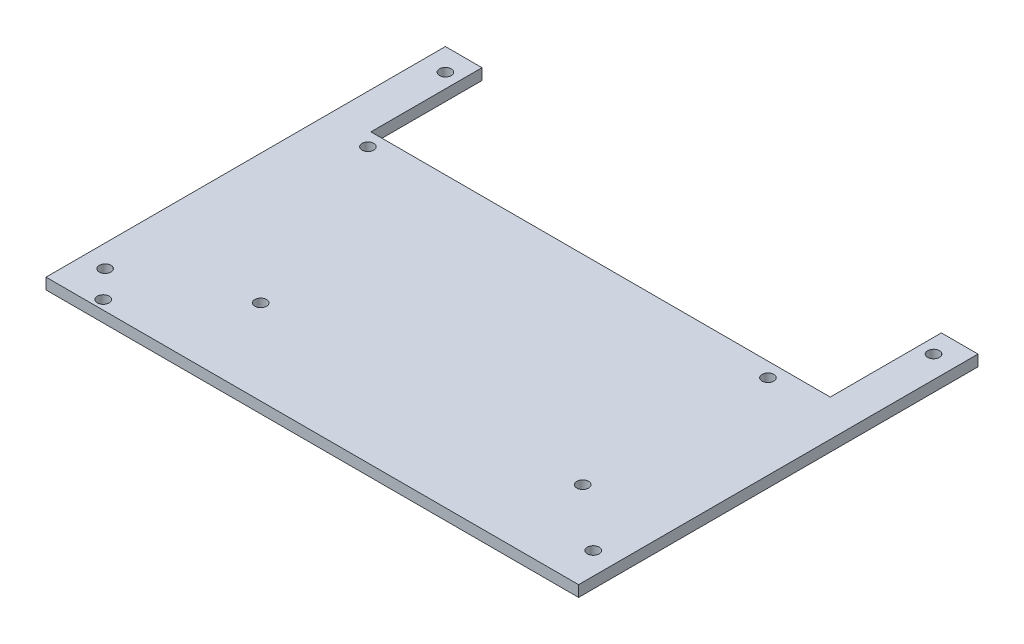
from build123d import *

# Parameters (mm, degrees)
SKETCH1_R      = 1.59
EXTRUDE1_DEPTH = 3
SKETCH2_W      = 124
SKETCH2_H      = 30
EXTRUDE2_DEPTH = 3
SKETCH3_R      = 1.59
EXTRUDE3_DEPTH = 3


with BuildPart() as part:
    # Sketch1 → Extrude1 (new body)
    with BuildSketch(Plane(origin=(0, 0, 0), x_dir=(1, 0, 0), z_dir=(0, 1, 0))):
        Polygon((-6, 97.8583), (137.7752, 97.8583), (137.7752, -6), (137.7752, -9.96), (131.7752, -9.96), (0, -9.96), (-6, -9.96), (-6, -6), align=None)
        with Locations(Location((0, 91.8583, 0), (0, 0, 270))):
            Circle(SKETCH1_R, mode=Mode.SUBTRACT)
        with Locations(Location((131.7752, 91.8583, 0), (0, 0, 270))):
            Circle(SKETCH1_R, mode=Mode.SUBTRACT)
        with Locations(Location((131.7752, 0, 0), (0, 0, 270))):
            Circle(SKETCH1_R, mode=Mode.SUBTRACT)
        with Locations(Location((0, 0, 0), (0, 0, 270))):
            Circle(SKETCH1_R, mode=Mode.SUBTRACT)
    extrude(amount=-EXTRUDE1_DEPTH)

    # Sketch2 → Extrude2 (cut)
    with BuildSketch(Plane(origin=(0, 0, 0), x_dir=(1, 0, 0), z_dir=(0, 1, 0))):
        with Locations((65.8876, 82.8583)):
            Rectangle(SKETCH2_W, SKETCH2_H)
    extrude(amount=-EXTRUDE2_DEPTH, mode=Mode.SUBTRACT)

    # Sketch3 → Extrude3 (cut)
    with BuildSketch(Plane(origin=(0, 0, 0), x_dir=(1, 0, 0), z_dir=(0, 1, 0))):
        with Locations(Location((6.961270646, -7.468844026, 0), (0, 0, 270))):
            Circle(SKETCH3_R)
        with Locations(Location((6.970466443, 63.970156522, 0), (0, 0, 270))):
            Circle(SKETCH3_R)
        with Locations(Location((114.970465448, 63.956254506, 0), (0, 0, 270))):
            Circle(SKETCH3_R)
        with Locations(Location((114.96402933, 13.95625332, 0), (0, 0, 270))):
            Circle(SKETCH3_R)
        with Locations(Location((29, 13, 0), (0, 0, 270))):
            Circle(SKETCH3_R)
    extrude(amount=-EXTRUDE3_DEPTH, mode=Mode.SUBTRACT)


solid = part.part
